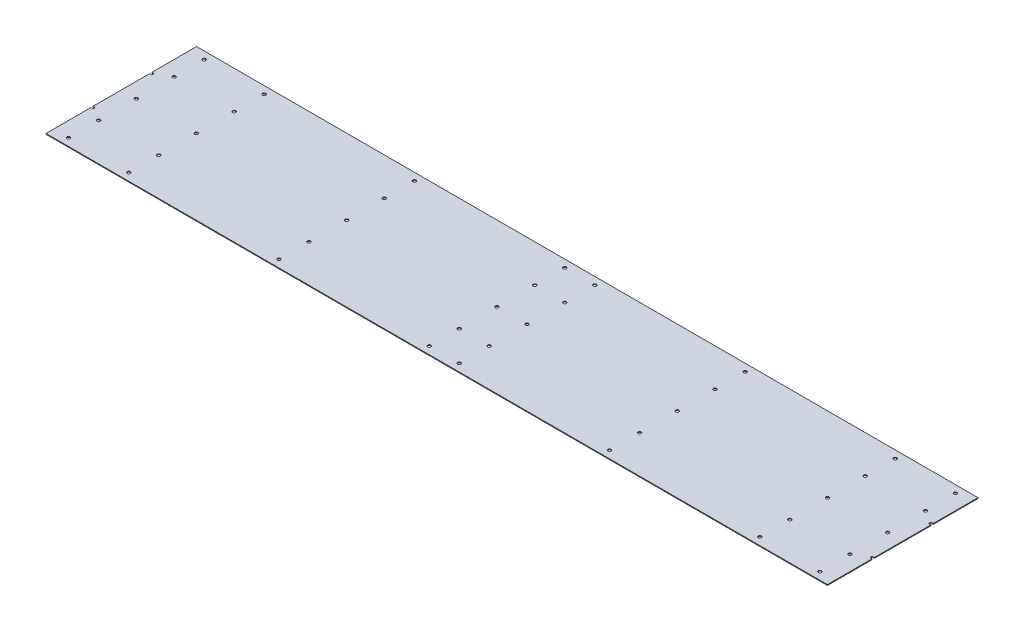
from build123d import *

# Parameters (mm, degrees)
SKETCH1_R           = 2.15
BOSS_EXTRUDE1_DEPTH = 1


with BuildPart() as part:
    # Sketch1 → Boss-Extrude1 (new body)
    with BuildSketch(Plane(origin=(0, 0, 0), x_dir=(1, 0, 0), z_dir=(0, 1, 0))):
        Polygon((-500, -40.7), (-500, -100.2), (540, -100.2), (540, -40.7), (537, -40.7), (537, -37.7), (540, -37.7), (540, 37.7), (537, 37.7), (537, 40.7), (540, 40.7), (540, 100.2), (-500, 100.2), (-500, 40.7), (-497, 40.7), (-497, 37.7), (-500, 37.7), (-500, -37.7), (-497, -37.7), (-497, -40.7), align=None)
        with Locations(Location((0, -50.2, 0), (0, 0, 270))):
            Circle(SKETCH1_R, mode=Mode.SUBTRACT)
        with Locations(Location((0, 50.2, 0), (0, 0, 270))):
            Circle(SKETCH1_R, mode=Mode.SUBTRACT)
        with Locations(Location((0, -90.2, 0), (0, 0, 270))):
            Circle(SKETCH1_R, mode=Mode.SUBTRACT)
        with Locations(Location((0, 90.2, 0), (0, 0, 270))):
            Circle(SKETCH1_R, mode=Mode.SUBTRACT)
        with Locations(Location((-200, -90.2, 0), (0, 0, 270))):
            Circle(SKETCH1_R, mode=Mode.SUBTRACT)
        with Locations(Location((-200, -50.2, 0), (0, 0, 270))):
            Circle(SKETCH1_R, mode=Mode.SUBTRACT)
        with Locations(Location((-200, 50.2, 0), (0, 0, 270))):
            Circle(SKETCH1_R, mode=Mode.SUBTRACT)
        with Locations(Location((-200, 90.2, 0), (0, 0, 270))):
            Circle(SKETCH1_R, mode=Mode.SUBTRACT)
        with Locations(Location((0, 0, 0), (0, 0, 270))):
            Circle(SKETCH1_R, mode=Mode.SUBTRACT)
        with Locations(Location((-200, 0, 0), (0, 0, 270))):
            Circle(SKETCH1_R, mode=Mode.SUBTRACT)
        with Locations(Location((-400, 0, 0), (0, 0, 270))):
            Circle(SKETCH1_R, mode=Mode.SUBTRACT)
        with Locations(Location((-400, -90.2, 0), (0, 0, 270))):
            Circle(SKETCH1_R, mode=Mode.SUBTRACT)
        with Locations(Location((-400, -50.2, 0), (0, 0, 270))):
            Circle(SKETCH1_R, mode=Mode.SUBTRACT)
        with Locations(Location((-400, 50.2, 0), (0, 0, 270))):
            Circle(SKETCH1_R, mode=Mode.SUBTRACT)
        with Locations(Location((-400, 90.2, 0), (0, 0, 270))):
            Circle(SKETCH1_R, mode=Mode.SUBTRACT)
        with Locations(Location((40, -90.2, 0), (0, 0, 270))):
            Circle(SKETCH1_R, mode=Mode.SUBTRACT)
        with Locations(Location((40, -50.2, 0), (0, 0, 270))):
            Circle(SKETCH1_R, mode=Mode.SUBTRACT)
        with Locations(Location((40, 0, 0), (0, 0, 270))):
            Circle(SKETCH1_R, mode=Mode.SUBTRACT)
        with Locations(Location((40, 50.2, 0), (0, 0, 270))):
            Circle(SKETCH1_R, mode=Mode.SUBTRACT)
        with Locations(Location((40, 90.2, 0), (0, 0, 270))):
            Circle(SKETCH1_R, mode=Mode.SUBTRACT)
        with Locations(Location((520, 90.2, 0), (0, 0, 270))):
            Circle(SKETCH1_R, mode=Mode.SUBTRACT)
        with Locations(Location((520, 50.2, 0), (0, 0, 270))):
            Circle(SKETCH1_R, mode=Mode.SUBTRACT)
        with Locations(Location((520, 0, 0), (0, 0, 270))):
            Circle(SKETCH1_R, mode=Mode.SUBTRACT)
        with Locations(Location((520, -50.2, 0), (0, 0, 270))):
            Circle(SKETCH1_R, mode=Mode.SUBTRACT)
        with Locations(Location((520, -90.2, 0), (0, 0, 270))):
            Circle(SKETCH1_R, mode=Mode.SUBTRACT)
        with Locations(Location((240, -90.2, 0), (0, 0, 270))):
            Circle(SKETCH1_R, mode=Mode.SUBTRACT)
        with Locations(Location((240, -50.2, 0), (0, 0, 270))):
            Circle(SKETCH1_R, mode=Mode.SUBTRACT)
        with Locations(Location((240, 0, 0), (0, 0, 270))):
            Circle(SKETCH1_R, mode=Mode.SUBTRACT)
        with Locations(Location((240, 50.2, 0), (0, 0, 270))):
            Circle(SKETCH1_R, mode=Mode.SUBTRACT)
        with Locations(Location((240, 90.2, 0), (0, 0, 270))):
            Circle(SKETCH1_R, mode=Mode.SUBTRACT)
        with Locations(Location((440, -90.2, 0), (0, 0, 270))):
            Circle(SKETCH1_R, mode=Mode.SUBTRACT)
        with Locations(Location((440, -50.2, 0), (0, 0, 270))):
            Circle(SKETCH1_R, mode=Mode.SUBTRACT)
        with Locations(Location((440, 0, 0), (0, 0, 270))):
            Circle(SKETCH1_R, mode=Mode.SUBTRACT)
        with Locations(Location((440, 50.2, 0), (0, 0, 270))):
            Circle(SKETCH1_R, mode=Mode.SUBTRACT)
        with Locations(Location((440, 90.2, 0), (0, 0, 270))):
            Circle(SKETCH1_R, mode=Mode.SUBTRACT)
        with Locations(Location((-480, 90.2, 0), (0, 0, 270))):
            Circle(SKETCH1_R, mode=Mode.SUBTRACT)
        with Locations(Location((-480, 50.2, 0), (0, 0, 270))):
            Circle(SKETCH1_R, mode=Mode.SUBTRACT)
        with Locations(Location((-480, 0, 0), (0, 0, 270))):
            Circle(SKETCH1_R, mode=Mode.SUBTRACT)
        with Locations(Location((-480, -90.2, 0), (0, 0, 270))):
            Circle(SKETCH1_R, mode=Mode.SUBTRACT)
        with Locations(Location((-480, -50.2, 0), (0, 0, 270))):
            Circle(SKETCH1_R, mode=Mode.SUBTRACT)
    extrude(amount=BOSS_EXTRUDE1_DEPTH)


solid = part.part
